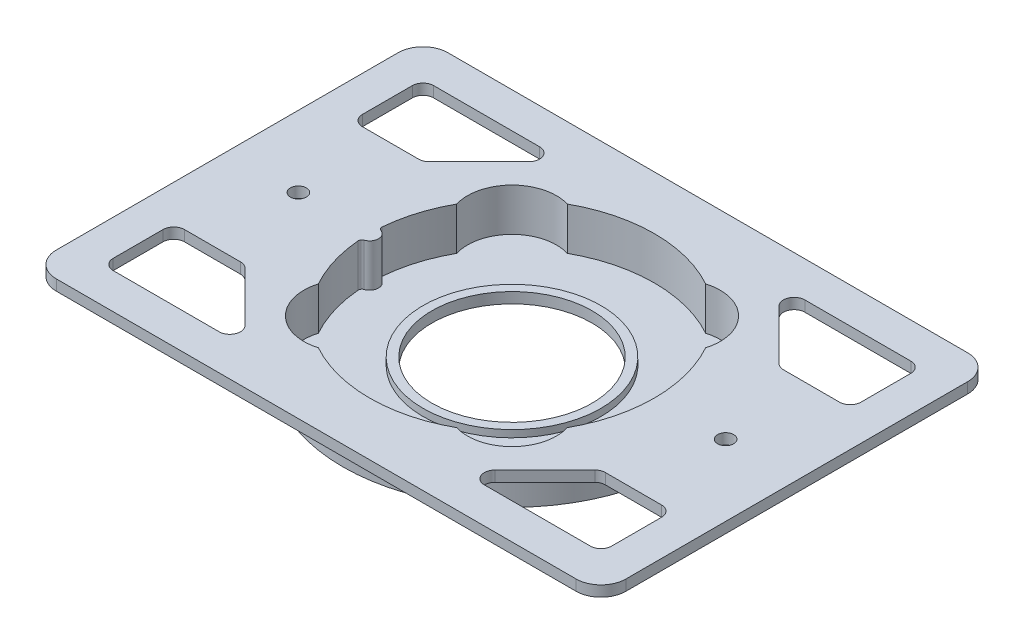
from build123d import *

# Parameters (mm, degrees)
SKETCH1_W           = 160
SKETCH1_H           = 110
BOSS_EXTRUDE1_DEPTH = 3
SKETCH2_R           = 47.5
BOSS_EXTRUDE3_DEPTH = 10
FILLET1_R           = 7
FILLET2_R           = 7
FILLET3_R           = 7
FILLET4_R           = 7
CUT_EXTRUDE3_DEPTH  = 12
SKETCH8_R           = 25
CUT_EXTRUDE4_DEPTH  = 12
SKETCH9_R           = 22.5
CUT_EXTRUDE5_DEPTH  = 15
SKETCH11_R          = 2.25
CUT_EXTRUDE7_DEPTH  = 9
SKETCH12_R          = 6
BOSS_EXTRUDE4_DEPTH = 2
CUT_EXTRUDE8_DEPTH  = 10
SKETCH10_R          = 25
CUT_EXTRUDE9_DEPTH  = 10


with BuildPart() as part:
    # Sketch1 → Boss-Extrude1 (new body)
    with BuildSketch(Plane(origin=(0, 0, 0), x_dir=(1, 0, 0), z_dir=(0, 1, 0))):
        with Locations((80, -55)):
            Rectangle(SKETCH1_W, SKETCH1_H)
    extrude(amount=BOSS_EXTRUDE1_DEPTH)

    # Sketch2 → Boss-Extrude3 (add)
    with BuildSketch(Plane.XZ):
        with Locations(Location((80, 55, 0), (0, 0, 270))):
            Circle(SKETCH2_R)
    extrude(amount=BOSS_EXTRUDE3_DEPTH)

    # Fillet1
    fillet1_edges = [part.edges().sort_by_distance(p)[0] for p in [
        (160, 1.5, 110),
    ]]
    fillet(fillet1_edges, radius=FILLET1_R)

    # Fillet2
    fillet2_edges = [part.edges().sort_by_distance(p)[0] for p in [
        (160, 1.5, 0),
    ]]
    fillet(fillet2_edges, radius=FILLET2_R)

    # Fillet3
    fillet3_edges = [part.edges().sort_by_distance(p)[0] for p in [
        (0, 1.5, 0),
    ]]
    fillet(fillet3_edges, radius=FILLET3_R)

    # Fillet4
    fillet4_edges = [part.edges().sort_by_distance(p)[0] for p in [
        (0, 1.5, 110),
    ]]
    fillet(fillet4_edges, radius=FILLET4_R)

    # Sketch3 → Cut-Extrude3 (cut)
    with BuildSketch(Plane(origin=(0, 3, 0), x_dir=(1, 0, 0), z_dir=(0, 1, 0))):
        with BuildLine():
            ThreePointArc((45.034735386, -74.427564708), (51.715728753, -83.284271247), (60.572435292, -89.965264614))
            ThreePointArc((60.572435292, -89.965264614), (48.180194847, -86.819805153), (45.034735386, -74.427564708))
        make_face()
        with BuildLine():
            ThreePointArc((60.572435292, -20.034735386), (48.180194847, -23.180194847), (45.034735386, -35.572435292))
            ThreePointArc((45.034735386, -35.572435292), (51.715728753, -26.715728753), (60.572435292, -20.034735386))
        make_face()
        with BuildLine():
            ThreePointArc((114.965264614, -35.572435292), (111.819805153, -23.180194847), (99.427564708, -20.034735386))
            ThreePointArc((99.427564708, -20.034735386), (108.284271247, -26.715728753), (114.965264614, -35.572435292))
        make_face()
        with BuildLine():
            ThreePointArc((99.427564708, -89.965264614), (111.819805153, -86.819805153), (114.965264614, -74.427564708))
            ThreePointArc((114.965264614, -74.427564708), (108.284271247, -83.284271247), (99.427564708, -89.965264614))
        make_face()
    extrude(amount=-CUT_EXTRUDE3_DEPTH, mode=Mode.SUBTRACT)

    # Sketch8 → Cut-Extrude4 (cut)
    with BuildSketch(Plane(origin=(0, 3, 0), x_dir=(1, 0, 0), z_dir=(0, 1, 0))):
        with BuildLine():
            ThreePointArc((40.144230769, -58.393767674), (120, -55), (40.144230769, -51.606232326))
            ThreePointArc((40.144230769, -51.606232326), (40.30249314, -52.236544193), (40.814732143, -52.636483227))
            ThreePointArc((40.814732143, -52.636483227), (42.5, -55), (40.814732143, -57.363516773))
            ThreePointArc((40.814732143, -57.363516773), (40.30249314, -57.763455807), (40.144230769, -58.393767674))
        make_face()
        with Locations(Location((80, -55, 0), (0, 0, 270))):
            Circle(SKETCH8_R, mode=Mode.SUBTRACT)
    extrude(amount=-CUT_EXTRUDE4_DEPTH, mode=Mode.SUBTRACT)

    # Sketch9 → Cut-Extrude5 (cut)
    with BuildSketch(Plane(origin=(0, 3, 0), x_dir=(1, 0, 0), z_dir=(0, 1, 0))):
        with Locations(Location((80, -55, 0), (0, 0, 270))):
            Circle(SKETCH9_R)
    extrude(amount=-CUT_EXTRUDE5_DEPTH, mode=Mode.SUBTRACT)

    # Sketch11 → Cut-Extrude7 (cut)
    with BuildSketch(Plane(origin=(0, 3, 0), x_dir=(1, 0, 0), z_dir=(0, 1, 0))):
        with Locations(Location((20, -55, 0), (0, 0, 270))):
            Circle(SKETCH11_R)
        with Locations(Location((140, -55, 0), (0, 0, 270))):
            Circle(SKETCH11_R)
    extrude(amount=-CUT_EXTRUDE7_DEPTH, mode=Mode.SUBTRACT)

    # Sketch12 → Boss-Extrude4 (add)
    # profile 1 of 2: a face of its own
    with BuildSketch(Plane.XZ):
        with Locations(Location((20, 55, 0), (0, 0, 270))):
            Circle(SKETCH12_R)
        with BuildLine():
            Line((23.75277675, 55.5), (22.309401077, 58))
            ThreePointArc((22.309401077, 58), (21.943375673, 58.366025404), (21.443375673, 58.5))
            Line((21.443375673, 58.5), (18.556624327, 58.5))
            ThreePointArc((18.556624327, 58.5), (18.056624327, 58.366025404), (17.690598923, 58))
            Line((17.690598923, 58), (16.24722325, 55.5))
            ThreePointArc((16.24722325, 55.5), (16.113248654, 55), (16.24722325, 54.5))
            Line((16.24722325, 54.5), (17.690598923, 52))
            ThreePointArc((17.690598923, 52), (18.056624327, 51.633974596), (18.556624327, 51.5))
            Line((18.556624327, 51.5), (21.443375673, 51.5))
            ThreePointArc((21.443375673, 51.5), (21.943375673, 51.633974596), (22.309401077, 52))
            Line((22.309401077, 52), (23.75277675, 54.5))
            ThreePointArc((23.75277675, 54.5), (23.886751346, 55), (23.75277675, 55.5))
        make_face(mode=Mode.SUBTRACT)
    # profile 2 of 2: a face of its own
    with BuildSketch(Plane.XZ):
        with Locations(Location((140, 55, 0), (0, 0, 90))):
            Circle(SKETCH12_R)
        with BuildLine():
            Line((137.690598923, 52), (136.24722325, 54.5))
            ThreePointArc((136.24722325, 54.5), (136.113248654, 55), (136.24722325, 55.5))
            Line((136.24722325, 55.5), (137.690598923, 58))
            ThreePointArc((137.690598923, 58), (138.056624327, 58.366025404), (138.556624327, 58.5))
            Line((138.556624327, 58.5), (141.443375673, 58.5))
            ThreePointArc((141.443375673, 58.5), (141.943375673, 58.366025404), (142.309401077, 58))
            Line((142.309401077, 58), (143.75277675, 55.5))
            ThreePointArc((143.75277675, 55.5), (143.886751346, 55), (143.75277675, 54.5))
            Line((143.75277675, 54.5), (142.309401077, 52))
            ThreePointArc((142.309401077, 52), (141.943375673, 51.633974596), (141.443375673, 51.5))
            Line((141.443375673, 51.5), (138.556624327, 51.5))
            ThreePointArc((138.556624327, 51.5), (138.056624327, 51.633974596), (137.690598923, 52))
        make_face(mode=Mode.SUBTRACT)
    extrude(amount=BOSS_EXTRUDE4_DEPTH)

    # Sketch13 → Cut-Extrude8 (cut)
    with BuildSketch(Plane(origin=(0, 3, 0), x_dir=(1, 0, 0), z_dir=(0, 1, 0))):
        with BuildLine():
            Line((10, -13), (10, -27))
            ThreePointArc((10, -27), (10.878679656, -29.121320344), (13, -30))
            Line((13, -30), (28.757359313, -30))
            ThreePointArc((28.757359313, -30), (29.90540961, -29.771638598), (30.878679656, -29.121320344))
            Line((30.878679656, -29.121320344), (44.878679656, -15.121320344))
            ThreePointArc((44.878679656, -15.121320344), (45.52899791, -11.851949703), (42.757359313, -10))
            Line((42.757359313, -10), (13, -10))
            ThreePointArc((13, -10), (10.878679656, -10.878679656), (10, -13))
        make_face()
        with BuildLine():
            Line((129.121320344, -29.121320344), (115.121320344, -15.121320344))
            ThreePointArc((115.121320344, -15.121320344), (114.47100209, -11.851949703), (117.242640687, -10))
            Line((117.242640687, -10), (147, -10))
            ThreePointArc((147, -10), (149.121320344, -10.878679656), (150, -13))
            Line((150, -13), (150, -27))
            ThreePointArc((150, -27), (149.121320344, -29.121320344), (147, -30))
            Line((147, -30), (131.242640687, -30))
            ThreePointArc((131.242640687, -30), (130.09459039, -29.771638598), (129.121320344, -29.121320344))
        make_face()
        with BuildLine():
            Line((150, -97), (150, -83))
            ThreePointArc((150, -83), (149.121320344, -80.878679656), (147, -80))
            Line((147, -80), (131.242640687, -80))
            ThreePointArc((131.242640687, -80), (130.09459039, -80.228361402), (129.121320344, -80.878679656))
            Line((129.121320344, -80.878679656), (115.121320344, -94.878679656))
            ThreePointArc((115.121320344, -94.878679656), (114.47100209, -98.148050297), (117.242640687, -100))
            Line((117.242640687, -100), (147, -100))
            ThreePointArc((147, -100), (149.121320344, -99.121320344), (150, -97))
        make_face()
        with BuildLine():
            Line((30.878679656, -80.878679656), (44.878679656, -94.878679656))
            ThreePointArc((44.878679656, -94.878679656), (45.52899791, -98.148050297), (42.757359313, -100))
            Line((42.757359313, -100), (13, -100))
            ThreePointArc((13, -100), (10.878679656, -99.121320344), (10, -97))
            Line((10, -97), (10, -83))
            ThreePointArc((10, -83), (10.878679656, -80.878679656), (13, -80))
            Line((13, -80), (28.757359313, -80))
            ThreePointArc((28.757359313, -80), (29.90540961, -80.228361402), (30.878679656, -80.878679656))
        make_face()
    extrude(amount=-CUT_EXTRUDE8_DEPTH, mode=Mode.SUBTRACT)

    # Sketch10 → Cut-Extrude9 (cut)
    with BuildSketch(Plane(origin=(0, 3, 0), x_dir=(1, 0, 0), z_dir=(0, 1, 0))):
        with Locations(Location((80, -55, 0), (0, 0, 270))):
            Circle(SKETCH10_R)
    extrude(amount=-CUT_EXTRUDE9_DEPTH, mode=Mode.SUBTRACT)


solid = part.part
